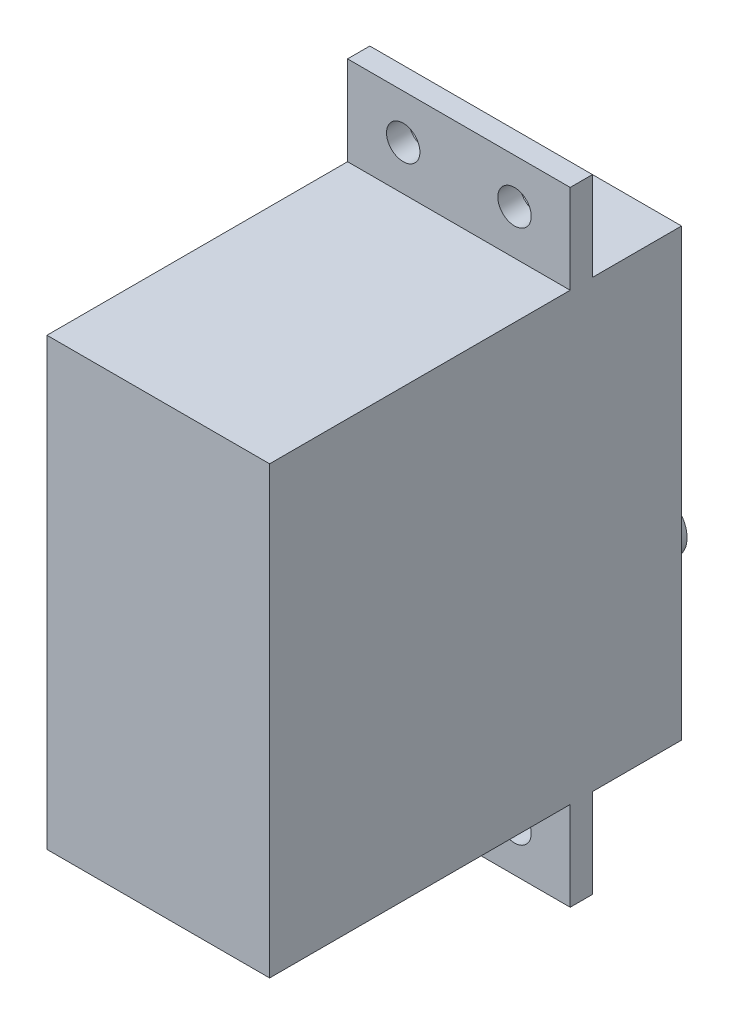
from build123d import *

# Parameters (mm, degrees)
SKETCH1_W           = 20
SKETCH1_H           = 40
BOSS_EXTRUDE1_DEPTH = 37
SKETCH2_W           = 20
SKETCH2_H           = 2
BOSS_EXTRUDE2_DEPTH = 8
SKETCH3_R           = 1.5
CUT_EXTRUDE2_DEPTH  = 48.465777145
SKETCH4_R           = 2.5
BOSS_EXTRUDE3_DEPTH = 8


with BuildPart() as part:
    # Sketch1 → Boss-Extrude1 (new body)
    with BuildSketch(Plane.XY):
        Rectangle(SKETCH1_W, SKETCH1_H)
    extrude(amount=BOSS_EXTRUDE1_DEPTH)

    # Sketch2 → Boss-Extrude2 (add)
    with BuildSketch(Plane(origin=(0, 20, 0), x_dir=(1, 0, 0), z_dir=(0, 1, 0))):
        with Locations((0, -9)):
            Rectangle(SKETCH2_W, SKETCH2_H)
    boss_extrude2 = extrude(amount=BOSS_EXTRUDE2_DEPTH)

    # Sketch3 → Cut-Extrude2 (cut, symmetric)
    with BuildSketch(Plane.XY):
        with Locations((5, 24)):
            Circle(SKETCH3_R)
        with Locations((-5, 24)):
            Circle(SKETCH3_R)
    cut_extrude2 = extrude(amount=CUT_EXTRUDE2_DEPTH, both=True, mode=Mode.SUBTRACT)

    # Mirror3: Boss-Extrude2, Cut-Extrude2 across plane
    add(boss_extrude2.mirror(Plane.ZX))
    add(cut_extrude2.mirror(Plane.ZX), mode=Mode.SUBTRACT)

    # Sketch4 → Boss-Extrude3 (add)
    with BuildSketch(Plane(origin=(0, 0, 0), x_dir=(-1, 0, 0), z_dir=(0, 0, -1))):
        with Locations((0, -12)):
            Circle(SKETCH4_R)
    extrude(amount=BOSS_EXTRUDE3_DEPTH)


solid = part.part
